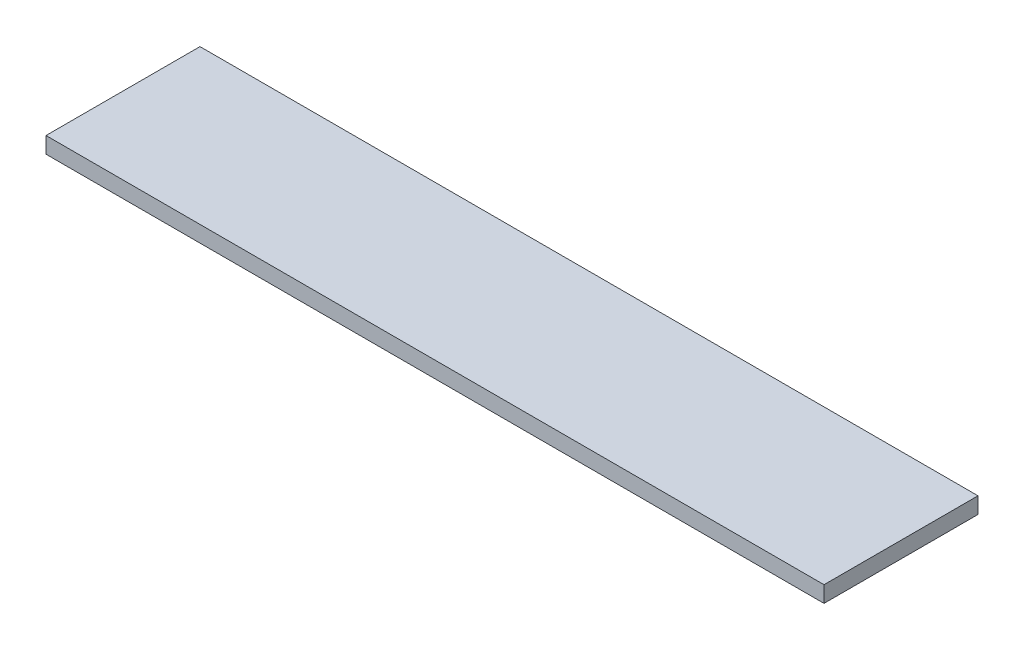
from build123d import *

# Parameters (mm, degrees)
SKETCH1_W           = 609.6
SKETCH1_H           = 120.65
BOSS_EXTRUDE1_DEPTH = 12.7


with BuildPart() as part:
    # Sketch1 → Boss-Extrude1 (new body)
    with BuildSketch(Plane(origin=(0, 0, 0), x_dir=(1, 0, 0), z_dir=(0, 1, 0))):
        with Locations((0, -60.325)):
            Rectangle(SKETCH1_W, SKETCH1_H)
    extrude(amount=BOSS_EXTRUDE1_DEPTH)


solid = part.part
